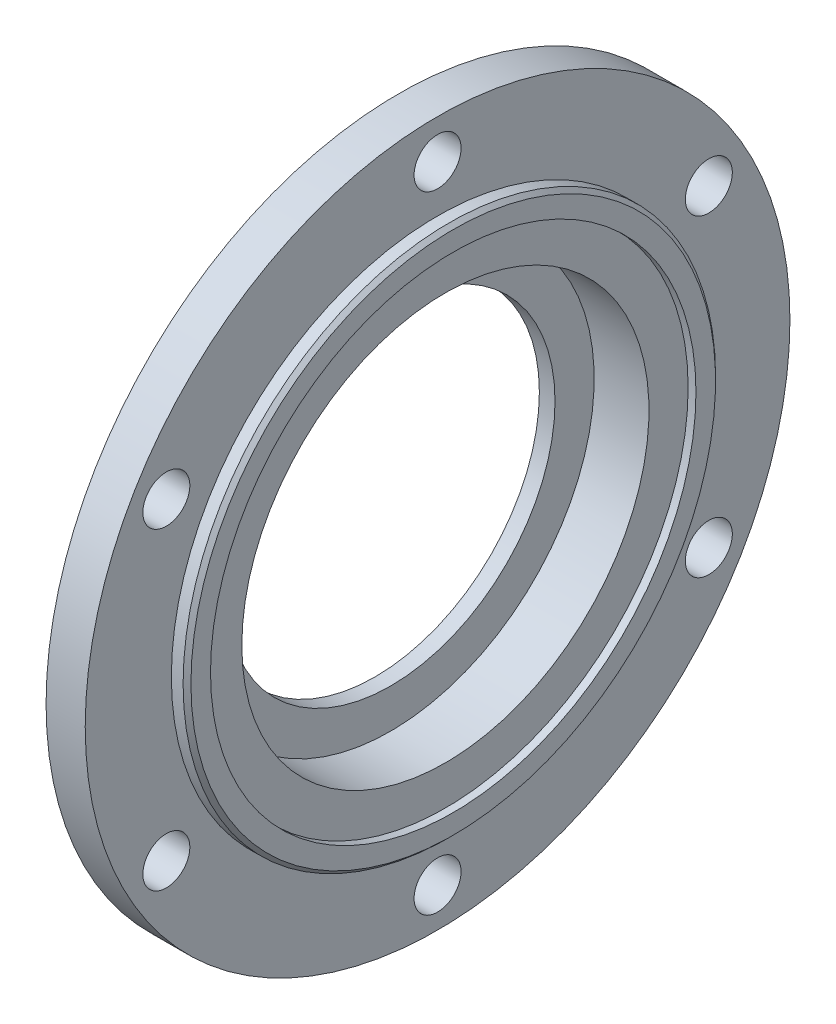
from build123d import *

# Parameters (mm, degrees)
SKETCH2_R          = 3
CUT_EXTRUDE1_DEPTH = 10


with BuildPart() as part:
    # Sketch1 → Revolve1 (revolve)
    with BuildSketch(Plane(origin=(0, 0, 0), x_dir=(1, 0, 0), z_dir=(0, 1, 0)), mode=Mode.PRIVATE) as revolve1_sk:
        Polygon((0, 21), (0, 31), (3, 34), (3, 45), (8, 45), (8, 34), (9.5, 34), (10, 33.5), (10, 31), (9, 31), (9, 26), (2, 26), (2, 21), align=None)
    revolve(revolve1_sk.sketch.rotate(Axis((0, 0, 0), (1, 0, 0)), 180), axis=Axis((0, 0, 0), (1, 0, 0)))

    # Sketch2 → Cut-Extrude1 (cut)
    with BuildSketch(Plane.ZY.offset(-3)):
        with Locations((0, 40)):
            Circle(SKETCH2_R)
        with Locations((34.641016151, 20)):
            Circle(SKETCH2_R)
        with Locations((34.641016151, -20)):
            Circle(SKETCH2_R)
        with Locations((0, -40)):
            Circle(SKETCH2_R)
        with Locations((-34.641016151, -20)):
            Circle(SKETCH2_R)
        with Locations((-34.641016151, 20)):
            Circle(SKETCH2_R)
    extrude(amount=-CUT_EXTRUDE1_DEPTH, mode=Mode.SUBTRACT)


solid = part.part
